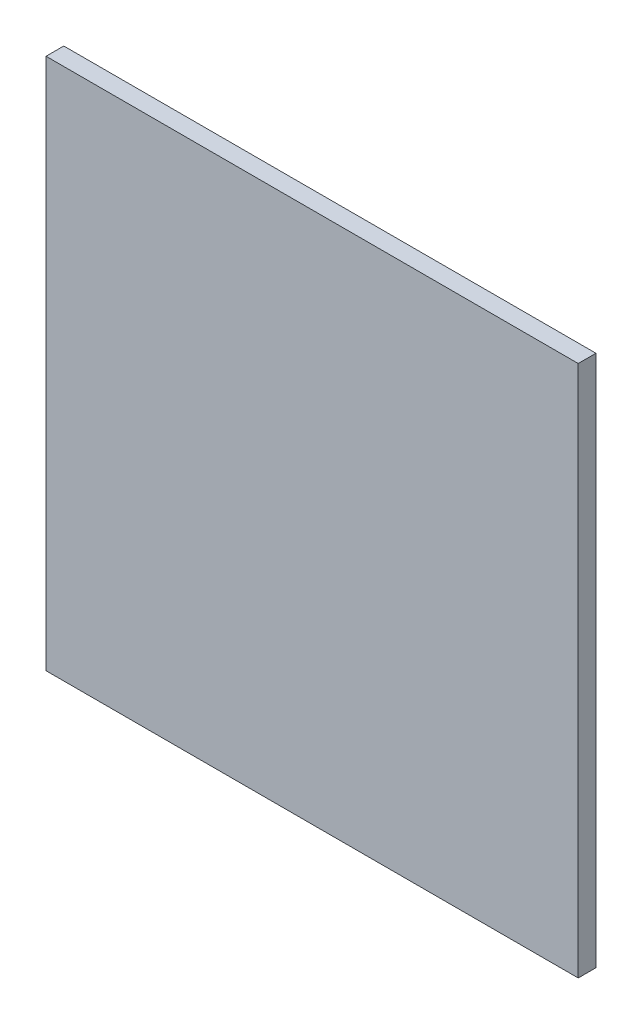
from build123d import *

# Parameters (mm, degrees)
ESQUISSE1_W        = 381
ESQUISSE1_H        = 381
BOSS_EXTRU_1_DEPTH = 12.7


with BuildPart() as part:
    # Esquisse1 → Boss.-Extru.1 (new body)
    with BuildSketch(Plane.XY):
        Rectangle(ESQUISSE1_W, ESQUISSE1_H)
    extrude(amount=BOSS_EXTRU_1_DEPTH)


solid = part.part
